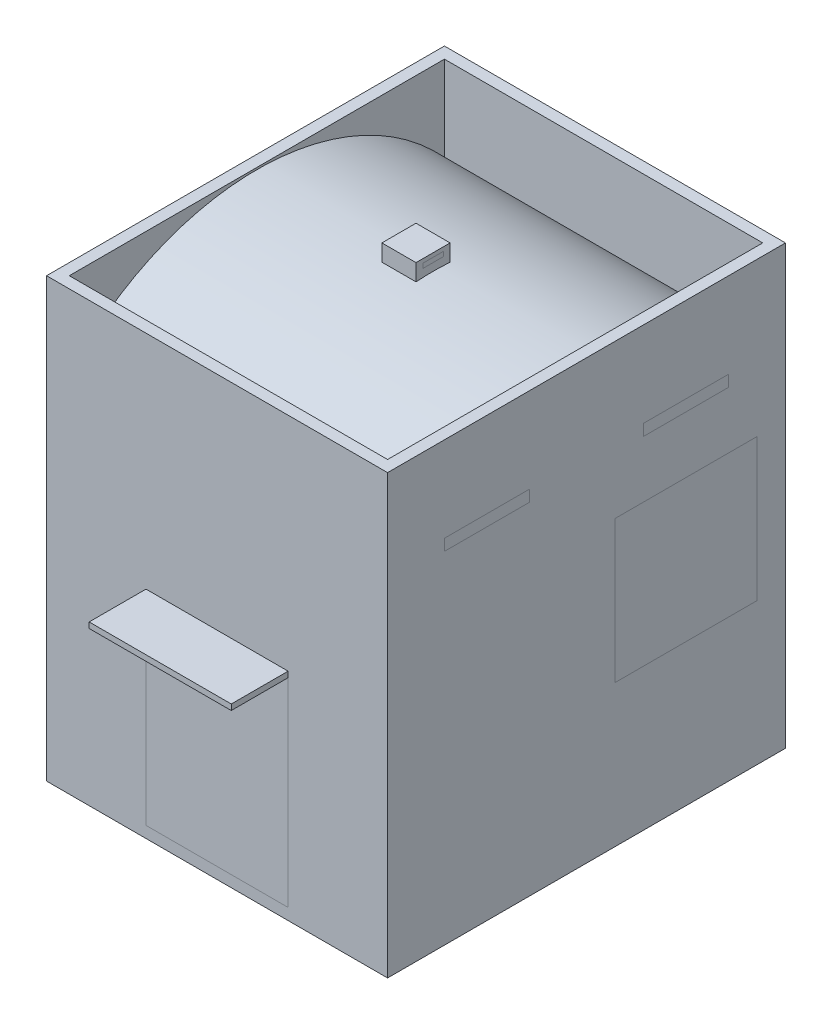
from build123d import *

# Parameters (mm, degrees)
SKETCH16_W             = 600
SKETCH16_H             = 700
BOSS_EXTRUDE1_DEPTH    = 20
SKETCH16_2_W           = 600
SKETCH16_2_H           = 700
BOSS_EXTRUDE2_DEPTH    = 750
SHELL1_T               = -20
SKETCH17_W             = 560
SKETCH17_H             = 20
SKETCH28_W             = 250
SKETCH28_H             = 250
CUT_EXTRUDE6_DEPTH     = 1023.252415013
SKETCH28_5_W           = 250
SKETCH28_5_H           = 250
CUT_EXTRUDE7_DEPTH     = 170
SKETCH28_6_W           = 150
SKETCH28_6_H           = 20
CUT_EXTRUDE8_DEPTH     = 1023.252415013
SKETCH28_7_W           = 150
SKETCH28_7_H           = 20
CUT_EXTRUDE9_DEPTH     = 1023.252415013
SKETCH35_W             = 250
SKETCH35_H             = 350
CUT_EXTRUDE10_DEPTH    = 170
SKETCH36_W             = 250
SKETCH36_H             = 10
BOSS_EXTRUDE6_DEPTH    = 100
SKETCH45_W             = 60
SKETCH45_H             = 60
BOSS_EXTRUDE7_DEPTH    = 40
SKETCH46_W             = 50
SKETCH46_H             = 50
CUT_EXTRUDE12_DEPTH    = 30
SKETCH47_W             = 60
SKETCH47_H             = 60
BOSS_EXTRUDE8_DEPTH    = 5
SKETCH48_W             = 36
SKETCH48_H             = 8
CUT_EXTRUDE13_DEPTH    = 63
SKETCH49_W             = 20
SKETCH49_H             = 350
BOSS_EXTRUDE10_DEPTH   = 250
SKETCH50_W             = 20
SKETCH50_H             = 250
BOSS_EXTRUDE11_DEPTH   = 250
SKETCH52_W             = 20
SKETCH52_H             = 250
BOSS_EXTRUDE12_DEPTH   = 250
SKETCH53_W             = 20
SKETCH53_H             = 250
BOSS_EXTRUDE13_DEPTH   = 250
SKETCH54_W             = 36
SKETCH54_H             = 8
BOSS_EXTRUDE14_DEPTH   = 60
SKETCH55_W             = 150
SKETCH55_H             = 20
BOSS_EXTRUDE15_DEPTH   = 20
BOSS_EXTRUDE15_2_DEPTH = 20
SKETCH56_W             = 150
SKETCH56_H             = 20
BOSS_EXTRUDE16_DEPTH   = 20
BOSS_EXTRUDE16_2_DEPTH = 20


with BuildPart() as part:
    # Sketch16 → Boss-Extrude1 (new body)
    with BuildSketch(Plane(origin=(0, 0, 0), x_dir=(1, 0, 0), z_dir=(0, 1, 0))):
        Rectangle(SKETCH16_W, SKETCH16_H)
    extrude(amount=-BOSS_EXTRUDE1_DEPTH)

    # Sketch16<2> → Boss-Extrude2 (add)
    with BuildSketch(Plane(origin=(0, 0, 0), x_dir=(1, 0, 0), z_dir=(0, 1, 0))):
        Rectangle(SKETCH16_2_W, SKETCH16_2_H)
    extrude(amount=BOSS_EXTRUDE2_DEPTH)

    # Shell1
    shell1_openings = [part.faces().sort_by_distance(p)[0] for p in [
        (0, 750, 0),
    ]]
    offset(amount=SHELL1_T, openings=shell1_openings, kind=Kind.INTERSECTION)

    # Sweep1: sweep along a path in Sketch18
    with BuildLine(Plane(origin=(0, 0, 0), x_dir=(0, 0, -1), z_dir=(1, 0, 0))) as sweep1_path:
        ThreePointArc((-330, 590), (0, 740), (330, 590))
    # Sketch17 → Sweep1 (sweep)
    with BuildSketch(Plane.XY.offset(330)):
        with Locations((0, 590)):
            Rectangle(SKETCH17_W, SKETCH17_H)
    sweep(path=sweep1_path.line)

    # Sketch28 → Cut-Extrude6 (cut, through all)
    with BuildSketch(Plane.ZY.offset(300)):
        with Locations((-175, 355)):
            Rectangle(SKETCH28_W, SKETCH28_H)
    extrude(amount=-CUT_EXTRUDE6_DEPTH, mode=Mode.SUBTRACT)

    # Sketch28<5> → Cut-Extrude7 (cut)
    with BuildSketch(Plane.ZY.offset(300)):
        with Locations((175, 355)):
            Rectangle(SKETCH28_5_W, SKETCH28_5_H)
    extrude(amount=-CUT_EXTRUDE7_DEPTH, mode=Mode.SUBTRACT)

    # Sketch28<6> → Cut-Extrude8 (cut, through all)
    with BuildSketch(Plane.ZY.offset(300)):
        with Locations((-175, 590)):
            Rectangle(SKETCH28_6_W, SKETCH28_6_H)
    extrude(amount=-CUT_EXTRUDE8_DEPTH, mode=Mode.SUBTRACT)

    # Sketch28<7> → Cut-Extrude9 (cut, through all)
    with BuildSketch(Plane.ZY.offset(300)):
        with Locations((175, 590)):
            Rectangle(SKETCH28_7_W, SKETCH28_7_H)
    extrude(amount=-CUT_EXTRUDE9_DEPTH, mode=Mode.SUBTRACT)

    # Sketch35 → Cut-Extrude10 (cut)
    with BuildSketch(Plane.XY.offset(350)):
        with Locations((0, 175)):
            Rectangle(SKETCH35_W, SKETCH35_H)
    extrude(amount=-CUT_EXTRUDE10_DEPTH, mode=Mode.SUBTRACT)

    # Sketch36 → Boss-Extrude6 (add)
    with BuildSketch(Plane.XY.offset(350)):
        with Locations((0, 355)):
            Rectangle(SKETCH36_W, SKETCH36_H)
    extrude(amount=BOSS_EXTRUDE6_DEPTH)

    # Sketch45 → Boss-Extrude7 (add)
    with BuildSketch(Plane(origin=(0, 730, 0), x_dir=(1, 0, 0), z_dir=(0, 1, 0))):
        Rectangle(SKETCH45_W, SKETCH45_H)
    extrude(amount=BOSS_EXTRUDE7_DEPTH)

    # Sketch46 → Cut-Extrude12 (cut)
    with BuildSketch(Plane(origin=(0, 730, 0), x_dir=(1, 0, 0), z_dir=(0, 1, 0))):
        Rectangle(SKETCH46_W, SKETCH46_H)
    extrude(amount=CUT_EXTRUDE12_DEPTH, mode=Mode.SUBTRACT)

    # Sketch47 → Boss-Extrude8 (add)
    with BuildSketch(Plane(origin=(0, 770, 0), x_dir=(1, 0, 0), z_dir=(0, 1, 0))):
        Rectangle(SKETCH47_W, SKETCH47_H)
    extrude(amount=BOSS_EXTRUDE8_DEPTH)

    # Sketch48 → Cut-Extrude13 (cut)
    with BuildSketch(Plane(origin=(30, 0, 0), x_dir=(0, 0, -1), z_dir=(1, 0, 0))):
        with Locations((0, 764)):
            Rectangle(SKETCH48_W, SKETCH48_H)
    extrude(amount=-CUT_EXTRUDE13_DEPTH, mode=Mode.SUBTRACT)


with BuildPart() as body_2:
    # Sketch49 → Boss-Extrude10 (new body)
    with BuildSketch(Plane.ZY.offset(-125)):
        with Locations((340, 175)):
            Rectangle(SKETCH49_W, SKETCH49_H)
    extrude(amount=BOSS_EXTRUDE10_DEPTH)


with BuildPart() as body_3:
    # Sketch50 → Boss-Extrude11 (new body)
    with BuildSketch(Plane.XY.offset(-300)):
        with Locations((290, 355)):
            Rectangle(SKETCH50_W, SKETCH50_H)
    extrude(amount=BOSS_EXTRUDE11_DEPTH)


with BuildPart() as body_4:
    # Sketch52 → Boss-Extrude12 (new body)
    with BuildSketch(Plane(origin=(0, 0, 300), x_dir=(-1, 0, 0), z_dir=(0, 0, -1))):
        with Locations((290, 355)):
            Rectangle(SKETCH52_W, SKETCH52_H)
    extrude(amount=BOSS_EXTRUDE12_DEPTH)


with BuildPart() as body_5:
    # Sketch53 → Boss-Extrude13 (new body)
    with BuildSketch(Plane.XY.offset(-300)):
        with Locations((-290, 355)):
            Rectangle(SKETCH53_W, SKETCH53_H)
    extrude(amount=BOSS_EXTRUDE13_DEPTH)


with BuildPart() as body_6:
    # Sketch54 → Boss-Extrude14 (new body)
    with BuildSketch(Plane.ZY.offset(30)):
        with Locations((0, 764)):
            Rectangle(SKETCH54_W, SKETCH54_H)
    extrude(amount=-BOSS_EXTRUDE14_DEPTH)


with BuildPart() as body_7:
    # Sketch55 → Boss-Extrude15 (new body)
    with BuildSketch(Plane(origin=(-280, 0, 0), x_dir=(0, 0, -1), z_dir=(1, 0, 0))):
        with Locations((175, 590)):
            Rectangle(SKETCH55_W, SKETCH55_H)
    extrude(amount=-BOSS_EXTRUDE15_DEPTH)


with BuildPart() as body_8:
    # Sketch55 → Boss-Extrude15 2 (new body)
    with BuildSketch(Plane(origin=(-280, 0, 0), x_dir=(0, 0, -1), z_dir=(1, 0, 0))):
        with Locations((-175, 590)):
            Rectangle(SKETCH55_W, SKETCH55_H)
    extrude(amount=-BOSS_EXTRUDE15_2_DEPTH)


with BuildPart() as body_9:
    # Sketch56 → Boss-Extrude16 (new body)
    with BuildSketch(Plane(origin=(300, 0, 0), x_dir=(0, 0, -1), z_dir=(1, 0, 0))):
        with Locations((175, 590)):
            Rectangle(SKETCH56_W, SKETCH56_H)
    extrude(amount=-BOSS_EXTRUDE16_DEPTH)


with BuildPart() as body_10:
    # Sketch56 → Boss-Extrude16 2 (new body)
    with BuildSketch(Plane(origin=(300, 0, 0), x_dir=(0, 0, -1), z_dir=(1, 0, 0))):
        with Locations((-175, 590)):
            Rectangle(SKETCH56_W, SKETCH56_H)
    extrude(amount=-BOSS_EXTRUDE16_2_DEPTH)


solid = Compound([part.part, body_2.part, body_3.part, body_4.part, body_5.part, body_6.part, body_7.part, body_8.part, body_9.part, body_10.part])
